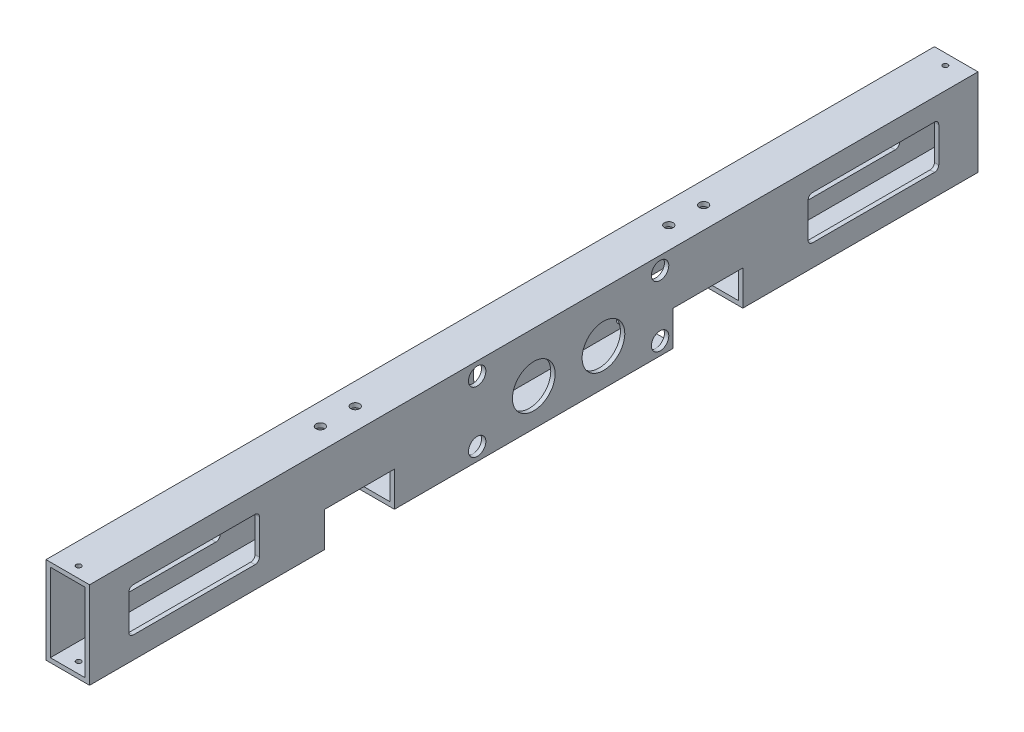
from build123d import *

# Parameters (mm, degrees)
SKETCH1_W           = 31.75
SKETCH1_H           = 63.5
SKETCH1_W_2         = 25.4
SKETCH1_H_2         = 57.15
BOSS_EXTRUDE1_DEPTH = 647.7
CUT_EXTRUDE1_REACH  = 653.339
SKETCH3_W           = 50.8
SKETCH3_H           = 25.4
CUT_EXTRUDE2_REACH  = 653.339
SKETCH6_R           = 15.5575
SKETCH6_R_2         = 3.175
CUT_EXTRUDE3_REACH  = 653.339
SKETCH7_R           = 6.35
SKETCH8_R           = 3.175
CUT_EXTRUDE4_DEPTH  = 652.099933119
CUT_EXTRUDE5_REACH  = 653.1
SKETCH9_R           = 1.8415


with BuildPart() as part:
    # Sketch1 → Boss-Extrude1 (new body)
    with BuildSketch(Plane.XY):
        with Locations((3.710272719, -29.23968021)):
            Rectangle(SKETCH1_W, SKETCH1_H)
        with Locations((3.710272719, -29.23968021)):
            Rectangle(SKETCH1_W_2, SKETCH1_H_2, mode=Mode.SUBTRACT)
    extrude(amount=BOSS_EXTRUDE1_DEPTH)

    # Cut-Extrude1: up to this face of the body (flat: up to its plane)
    cut_extrude1_end = Plane(part.part.faces().sort_by_distance((19.585272719, -29.23968021, 323.85))[0])
    # Sketch3 → Cut-Extrude1 (cut, up to the picked face)
    with BuildSketch(Plane.ZY.offset(12.164727281), mode=Mode.PRIVATE) as cut_extrude1_sk1:
        with BuildLine():
            Line((31.7754, -13.36468021), (120.6754, -13.36468021))
            ThreePointArc((120.6754, -13.36468021), (122.92046403, -14.294616179), (123.8504, -16.53968021))
            Line((123.8504, -16.53968021), (123.8504, -41.93968021))
            ThreePointArc((123.8504, -41.93968021), (122.92046403, -44.18474424), (120.6754, -45.11468021))
            Line((120.6754, -45.11468021), (31.7754, -45.11468021))
            ThreePointArc((31.7754, -45.11468021), (29.53033597, -44.18474424), (28.6004, -41.93968021))
            Line((28.6004, -41.93968021), (28.6004, -16.53968021))
            ThreePointArc((28.6004, -16.53968021), (29.53033597, -14.294616179), (31.7754, -13.36468021))
        make_face()
    cut_extrude1_tool1 = split(extrude(cut_extrude1_sk1.sketch, amount=-CUT_EXTRUDE1_REACH, mode=Mode.PRIVATE), bisect_by=cut_extrude1_end, keep=Keep.BOTH, mode=Mode.PRIVATE)
    # Sketch3 → Cut-Extrude1 (cut, up to the picked face)
    with BuildSketch(Plane.ZY.offset(12.164727281), mode=Mode.PRIVATE) as cut_extrude1_sk2:
        with BuildLine():
            ThreePointArc((619.0996, -41.93968021), (618.16966403, -44.18474424), (615.9246, -45.11468021))
            Line((615.9246, -45.11468021), (527.0246, -45.11468021))
            ThreePointArc((527.0246, -45.11468021), (524.77953597, -44.18474424), (523.8496, -41.93968021))
            Line((523.8496, -41.93968021), (523.8496, -16.53968021))
            ThreePointArc((523.8496, -16.53968021), (524.77953597, -14.294616179), (527.0246, -13.36468021))
            Line((527.0246, -13.36468021), (615.9246, -13.36468021))
            ThreePointArc((615.9246, -13.36468021), (618.16966403, -14.294616179), (619.0996, -16.53968021))
            Line((619.0996, -16.53968021), (619.0996, -41.93968021))
        make_face()
    cut_extrude1_tool2 = split(extrude(cut_extrude1_sk2.sketch, amount=-CUT_EXTRUDE1_REACH, mode=Mode.PRIVATE), bisect_by=cut_extrude1_end, keep=Keep.BOTH, mode=Mode.PRIVATE)
    # Sketch3 → Cut-Extrude1 (cut, up to the picked face)
    with BuildSketch(Plane.ZY.offset(12.164727281), mode=Mode.PRIVATE) as cut_extrude1_sk3:
        with Locations((196.85, -48.28968021)):
            Rectangle(SKETCH3_W, SKETCH3_H)
    cut_extrude1_tool3 = split(extrude(cut_extrude1_sk3.sketch, amount=-CUT_EXTRUDE1_REACH, mode=Mode.PRIVATE), bisect_by=cut_extrude1_end, keep=Keep.BOTH, mode=Mode.PRIVATE)
    # Sketch3 → Cut-Extrude1 (cut, up to the picked face)
    with BuildSketch(Plane.ZY.offset(12.164727281), mode=Mode.PRIVATE) as cut_extrude1_sk4:
        with Locations((450.85, -48.28968021)):
            Rectangle(SKETCH3_W, SKETCH3_H)
    cut_extrude1_tool4 = split(extrude(cut_extrude1_sk4.sketch, amount=-CUT_EXTRUDE1_REACH, mode=Mode.PRIVATE), bisect_by=cut_extrude1_end, keep=Keep.BOTH, mode=Mode.PRIVATE)
    add(cut_extrude1_tool1.solids().sort_by(Axis((-12.164727, -29.23968, 76.2254), (1, 0, 0)))[0], mode=Mode.SUBTRACT)
    add(cut_extrude1_tool2.solids().sort_by(Axis((-12.164727, -29.23968, 571.4746), (1, 0, 0)))[0], mode=Mode.SUBTRACT)
    add(cut_extrude1_tool3.solids().sort_by(Axis((-12.164727, -48.28968, 196.85), (1, 0, 0)))[0], mode=Mode.SUBTRACT)
    add(cut_extrude1_tool4.solids().sort_by(Axis((-12.164727, -48.28968, 450.85), (1, 0, 0)))[0], mode=Mode.SUBTRACT)

    # Cut-Extrude2: up to this face of the body (flat: up to its plane)
    cut_extrude2_end = Plane(part.part.faces().sort_by_distance((-12.164727281, -27.727830199, 323.85))[0])
    # Sketch6 → Cut-Extrude2 (cut, up to the picked face)
    with BuildSketch(Plane(origin=(19.585272719, 0, 0), x_dir=(0, 0, -1), z_dir=(1, 0, 0)), mode=Mode.PRIVATE) as cut_extrude2_sk1:
        with Locations(Location((-323.85, -34.00218021, 0), (0, 0, 90))):
            Circle(SKETCH6_R)
    cut_extrude2_tool1 = split(extrude(cut_extrude2_sk1.sketch, amount=-CUT_EXTRUDE2_REACH, mode=Mode.PRIVATE), bisect_by=cut_extrude2_end, keep=Keep.BOTH, mode=Mode.PRIVATE)
    # Sketch6 → Cut-Extrude2 (cut, up to the picked face)
    with BuildSketch(Plane(origin=(19.585272719, 0, 0), x_dir=(0, 0, -1), z_dir=(1, 0, 0)), mode=Mode.PRIVATE) as cut_extrude2_sk2:
        with Locations(Location((-273.05, -34.00218021, 0), (0, 0, 90))):
            Circle(SKETCH6_R)
    cut_extrude2_tool2 = split(extrude(cut_extrude2_sk2.sketch, amount=-CUT_EXTRUDE2_REACH, mode=Mode.PRIVATE), bisect_by=cut_extrude2_end, keep=Keep.BOTH, mode=Mode.PRIVATE)
    # Sketch6 → Cut-Extrude2 (cut, up to the picked face)
    with BuildSketch(Plane(origin=(19.585272719, 0, 0), x_dir=(0, 0, -1), z_dir=(1, 0, 0)), mode=Mode.PRIVATE) as cut_extrude2_sk3:
        with Locations(Location((-365.125, -7.01468021, 0), (0, 0, 90))):
            Circle(SKETCH6_R_2)
    cut_extrude2_tool3 = split(extrude(cut_extrude2_sk3.sketch, amount=-CUT_EXTRUDE2_REACH, mode=Mode.PRIVATE), bisect_by=cut_extrude2_end, keep=Keep.BOTH, mode=Mode.PRIVATE)
    # Sketch6 → Cut-Extrude2 (cut, up to the picked face)
    with BuildSketch(Plane(origin=(19.585272719, 0, 0), x_dir=(0, 0, -1), z_dir=(1, 0, 0)), mode=Mode.PRIVATE) as cut_extrude2_sk4:
        with Locations(Location((-231.775, -7.01468021, 0), (0, 0, 90))):
            Circle(SKETCH6_R_2)
    cut_extrude2_tool4 = split(extrude(cut_extrude2_sk4.sketch, amount=-CUT_EXTRUDE2_REACH, mode=Mode.PRIVATE), bisect_by=cut_extrude2_end, keep=Keep.BOTH, mode=Mode.PRIVATE)
    # Sketch6 → Cut-Extrude2 (cut, up to the picked face)
    with BuildSketch(Plane(origin=(19.585272719, 0, 0), x_dir=(0, 0, -1), z_dir=(1, 0, 0)), mode=Mode.PRIVATE) as cut_extrude2_sk5:
        with Locations(Location((-365.125, -51.46468021, 0), (0, 0, 90))):
            Circle(SKETCH6_R_2)
    cut_extrude2_tool5 = split(extrude(cut_extrude2_sk5.sketch, amount=-CUT_EXTRUDE2_REACH, mode=Mode.PRIVATE), bisect_by=cut_extrude2_end, keep=Keep.BOTH, mode=Mode.PRIVATE)
    # Sketch6 → Cut-Extrude2 (cut, up to the picked face)
    with BuildSketch(Plane(origin=(19.585272719, 0, 0), x_dir=(0, 0, -1), z_dir=(1, 0, 0)), mode=Mode.PRIVATE) as cut_extrude2_sk6:
        with Locations(Location((-231.775, -51.46468021, 0), (0, 0, 90))):
            Circle(SKETCH6_R_2)
    cut_extrude2_tool6 = split(extrude(cut_extrude2_sk6.sketch, amount=-CUT_EXTRUDE2_REACH, mode=Mode.PRIVATE), bisect_by=cut_extrude2_end, keep=Keep.BOTH, mode=Mode.PRIVATE)
    add(cut_extrude2_tool1.solids().sort_by(Axis((19.585273, -34.00218, 323.85), (-1, 0, 0)))[0], mode=Mode.SUBTRACT)
    add(cut_extrude2_tool2.solids().sort_by(Axis((19.585273, -34.00218, 273.05), (-1, 0, 0)))[0], mode=Mode.SUBTRACT)
    add(cut_extrude2_tool3.solids().sort_by(Axis((19.585273, -7.01468, 365.125), (-1, 0, 0)))[0], mode=Mode.SUBTRACT)
    add(cut_extrude2_tool4.solids().sort_by(Axis((19.585273, -7.01468, 231.775), (-1, 0, 0)))[0], mode=Mode.SUBTRACT)
    add(cut_extrude2_tool5.solids().sort_by(Axis((19.585273, -51.46468, 365.125), (-1, 0, 0)))[0], mode=Mode.SUBTRACT)
    add(cut_extrude2_tool6.solids().sort_by(Axis((19.585273, -51.46468, 231.775), (-1, 0, 0)))[0], mode=Mode.SUBTRACT)

    # Sketch7 → Cut-Extrude3 (cut, up to next)
    with BuildSketch(Plane(origin=(19.585272719, 0, 0), x_dir=(0, 0, -1), z_dir=(1, 0, 0)), mode=Mode.PRIVATE) as cut_extrude3_sk1:
        with Locations(Location((-365.125, -7.01468021, 0), (0, 0, 90))):
            Circle(SKETCH7_R)
    cut_extrude3_tool1 = extrude(cut_extrude3_sk1.sketch, amount=-CUT_EXTRUDE3_REACH, mode=Mode.PRIVATE) & part.part
    # Sketch7 → Cut-Extrude3 (cut, up to next)
    with BuildSketch(Plane(origin=(19.585272719, 0, 0), x_dir=(0, 0, -1), z_dir=(1, 0, 0)), mode=Mode.PRIVATE) as cut_extrude3_sk2:
        with Locations(Location((-365.125, -51.46468021, 0), (0, 0, 90))):
            Circle(SKETCH7_R)
    cut_extrude3_tool2 = extrude(cut_extrude3_sk2.sketch, amount=-CUT_EXTRUDE3_REACH, mode=Mode.PRIVATE) & part.part
    # Sketch7 → Cut-Extrude3 (cut, up to next)
    with BuildSketch(Plane(origin=(19.585272719, 0, 0), x_dir=(0, 0, -1), z_dir=(1, 0, 0)), mode=Mode.PRIVATE) as cut_extrude3_sk3:
        with Locations(Location((-231.775, -51.46468021, 0), (0, 0, 90))):
            Circle(SKETCH7_R)
    cut_extrude3_tool3 = extrude(cut_extrude3_sk3.sketch, amount=-CUT_EXTRUDE3_REACH, mode=Mode.PRIVATE) & part.part
    # Sketch7 → Cut-Extrude3 (cut, up to next)
    with BuildSketch(Plane(origin=(19.585272719, 0, 0), x_dir=(0, 0, -1), z_dir=(1, 0, 0)), mode=Mode.PRIVATE) as cut_extrude3_sk4:
        with Locations(Location((-231.775, -7.01468021, 0), (0, 0, 90))):
            Circle(SKETCH7_R)
    cut_extrude3_tool4 = extrude(cut_extrude3_sk4.sketch, amount=-CUT_EXTRUDE3_REACH, mode=Mode.PRIVATE) & part.part
    add(cut_extrude3_tool1.solids().sort_by_distance((19.585273, -7.01468, 365.125))[0], mode=Mode.SUBTRACT)
    add(cut_extrude3_tool2.solids().sort_by_distance((19.585273, -51.46468, 365.125))[0], mode=Mode.SUBTRACT)
    add(cut_extrude3_tool3.solids().sort_by_distance((19.585273, -51.46468, 231.775))[0], mode=Mode.SUBTRACT)
    add(cut_extrude3_tool4.solids().sort_by_distance((19.585273, -7.01468, 231.775))[0], mode=Mode.SUBTRACT)

    # Sketch8 → Cut-Extrude4 (cut, through all)
    with BuildSketch(Plane(origin=(0, 2.51031979, 0), x_dir=(1, 0, 0), z_dir=(0, 1, 0))):
        with Locations(Location((3.710272719, -184.15, 0), (0, 0, 180))):
            Circle(SKETCH8_R)
        with Locations(Location((3.710272719, -209.55, 0), (0, 0, 180))):
            Circle(SKETCH8_R)
        with Locations(Location((3.710272719, -438.15, 0), (0, 0, 90))):
            Circle(SKETCH8_R)
        with Locations(Location((3.710272719, -463.55, 0), (0, 0, 90))):
            Circle(SKETCH8_R)
    extrude(amount=-CUT_EXTRUDE4_DEPTH, mode=Mode.SUBTRACT)

    # Cut-Extrude5: up to this face of the body (flat: up to its plane)
    cut_extrude5_end = Plane(part.part.faces().sort_by_distance((3.710272719, -60.98968021, 561.975))[0])
    # Sketch9 → Cut-Extrude5 (cut, up to the picked face)
    with BuildSketch(Plane(origin=(0, 2.51031979, 0), x_dir=(1, 0, 0), z_dir=(0, 1, 0)), mode=Mode.PRIVATE) as cut_extrude5_sk1:
        with Locations(Location((3.710272719, -639.7625, 0), (0, 0, 180))):
            Circle(SKETCH9_R)
    cut_extrude5_tool1 = split(extrude(cut_extrude5_sk1.sketch, amount=-CUT_EXTRUDE5_REACH, mode=Mode.PRIVATE), bisect_by=cut_extrude5_end, keep=Keep.BOTH, mode=Mode.PRIVATE)
    # Sketch9 → Cut-Extrude5 (cut, up to the picked face)
    with BuildSketch(Plane(origin=(0, 2.51031979, 0), x_dir=(1, 0, 0), z_dir=(0, 1, 0)), mode=Mode.PRIVATE) as cut_extrude5_sk2:
        with Locations(Location((3.710272719, -7.9375, 0), (0, 0, 180))):
            Circle(SKETCH9_R)
    cut_extrude5_tool2 = split(extrude(cut_extrude5_sk2.sketch, amount=-CUT_EXTRUDE5_REACH, mode=Mode.PRIVATE), bisect_by=cut_extrude5_end, keep=Keep.BOTH, mode=Mode.PRIVATE)
    add(cut_extrude5_tool1.solids().sort_by(Axis((3.710273, 2.51032, 639.7625), (0, -1, 0)))[0], mode=Mode.SUBTRACT)
    add(cut_extrude5_tool2.solids().sort_by(Axis((3.710273, 2.51032, 7.9375), (0, -1, 0)))[0], mode=Mode.SUBTRACT)


solid = part.part
